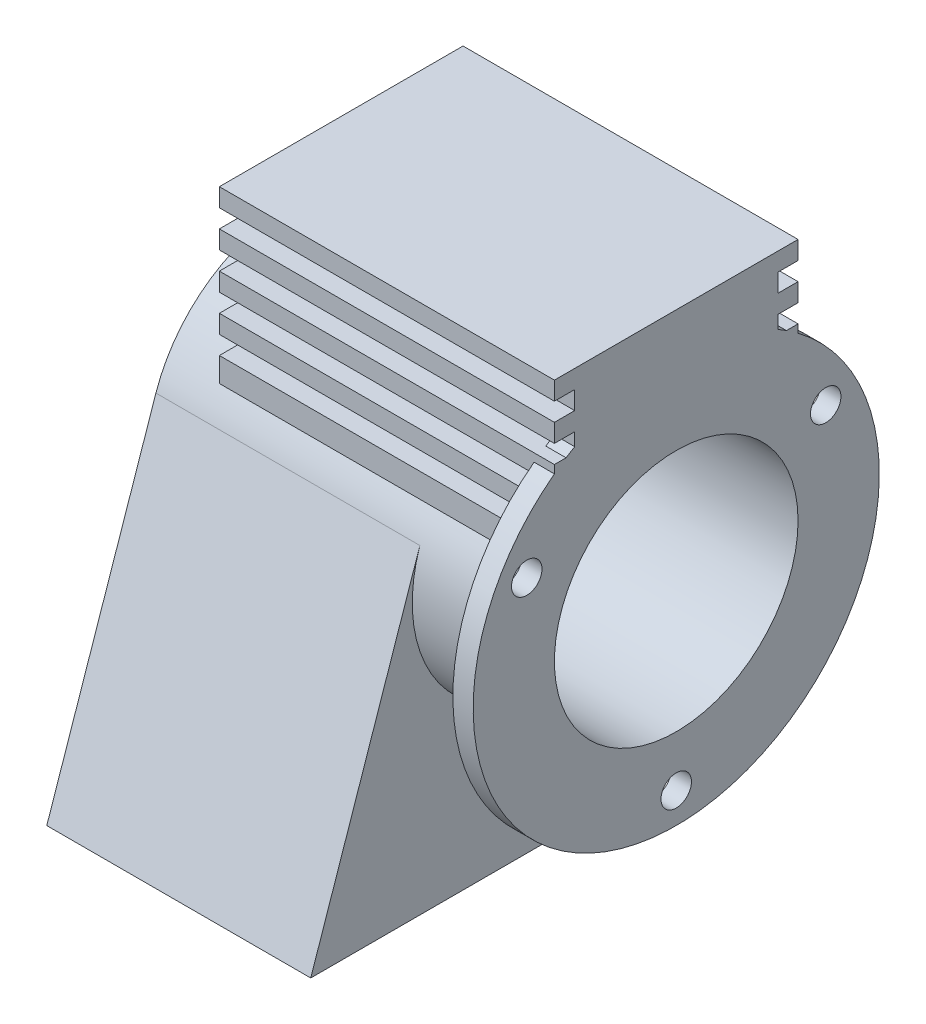
from build123d import *

# Parameters (mm, degrees)
BOSS_EXTRUDE1_DEPTH                                 = 165.1
SKETCH1_3_R                                         = 88.9
BOSS_EXTRUDE2_DEPTH                                 = 228.6
SKETCH2_R                                           = 127
BOSS_EXTRUDE3_DEPTH                                 = 12.7
BOSS_EXTRUDE4_START                                 = -209.55
BOSS_EXTRUDE4_DEPTH                                 = 209.55
CBORE_FOR_00_BINDING_HEAD_MACHINE_SCREW_D           = 38.1
CBORE_FOR_00_BINDING_HEAD_MACHINE_SCREW_CBORE_D     = 152.4
CBORE_FOR_00_BINDING_HEAD_MACHINE_SCREW_CBORE_DEPTH = 228.6
F_97_0_75_DIAMETER_HOLE1_D                          = 19.05
F_97_0_75_DIAMETER_HOLE1_DEPTH                      = 12.7
CIRPATTERN1_COUNT                                   = 3


with BuildPart() as part:
    # Sketch1 → Boss-Extrude1 (new body)
    with BuildSketch(Plane(origin=(0, 0, 0), x_dir=(0, 0, -1), z_dir=(1, 0, 0))):
        with BuildLine():
            Line((-84.14126771, 200.145941668), (-152.4, 0))
            Line((-152.4, 0), (152.4, 0))
            Line((152.4, 0), (84.14126771, 200.145941668))
            ThreePointArc((84.14126771, 200.145941668), (87.702248259, 185.993921421), (88.9, 171.45))
            ThreePointArc((88.9, 171.45), (-14.543921421, 83.747751741), (-84.14126771, 200.145941668))
        make_face()
    extrude(amount=BOSS_EXTRUDE1_DEPTH)

    # Sketch1<3> → Boss-Extrude2 (add)
    with BuildSketch(Plane(origin=(0, 0, 0), x_dir=(0, 0, -1), z_dir=(1, 0, 0))):
        with Locations(Location((0, 171.45, 0), (0, 0, 161.168324383))):
            Circle(SKETCH1_3_R)
    extrude(amount=BOSS_EXTRUDE2_DEPTH)

    # Sketch2 → Boss-Extrude3 (add)
    with BuildSketch(Plane(origin=(228.6, 0, 0), x_dir=(0, 0, -1), z_dir=(1, 0, 0))):
        with Locations((0, 171.45)):
            Circle(SKETCH2_R)
    extrude(amount=BOSS_EXTRUDE3_DEPTH)

    # Sketch3 → Boss-Extrude4 (add)
    with BuildSketch(Plane(origin=(241.3, 0, 0), x_dir=(0, 0, -1), z_dir=(1, 0, 0)).offset(BOSS_EXTRUDE4_START)):
        with BuildLine():
            Line((-76.2, 217.240501198), (-76.2, 232.41))
            Line((-76.2, 232.41), (-64.707715151, 232.41))
            ThreePointArc((-64.707715151, 232.41), (-70.860951664, 225.133661661), (-76.2, 217.240501198))
        make_face()
        with BuildLine():
            Line((-63.5, 233.667039467), (-63.5, 243.84))
            Line((-63.5, 243.84), (-76.2, 243.84))
            Line((-76.2, 243.84), (-76.2, 255.27))
            Line((-76.2, 255.27), (-63.5, 255.27))
            Line((-63.5, 255.27), (-63.5, 266.7))
            Line((-63.5, 266.7), (-76.2, 266.7))
            Line((-76.2, 266.7), (-76.2, 278.13))
            Line((-76.2, 278.13), (-63.5, 278.13))
            Line((-63.5, 278.13), (-63.5, 289.56))
            Line((-63.5, 289.56), (-76.2, 289.56))
            Line((-76.2, 289.56), (-76.2, 300.99))
            Line((-76.2, 300.99), (-63.5, 300.99))
            Line((-63.5, 300.99), (-63.5, 312.42))
            Line((-63.5, 312.42), (-76.2, 312.42))
            Line((-76.2, 312.42), (-76.2, 323.85))
            Line((-76.2, 323.85), (76.2, 323.85))
            Line((76.2, 323.85), (76.2, 312.42))
            Line((76.2, 312.42), (63.5, 312.42))
            Line((63.5, 312.42), (63.5, 300.99))
            Line((63.5, 300.99), (76.2, 300.99))
            Line((76.2, 300.99), (76.2, 289.56))
            Line((76.2, 289.56), (63.5, 289.56))
            Line((63.5, 289.56), (63.5, 278.13))
            Line((63.5, 278.13), (76.2, 278.13))
            Line((76.2, 278.13), (76.2, 266.7))
            Line((76.2, 266.7), (63.5, 266.7))
            Line((63.5, 266.7), (63.5, 255.27))
            Line((63.5, 255.27), (76.2, 255.27))
            Line((76.2, 255.27), (76.2, 243.84))
            Line((76.2, 243.84), (63.5, 243.84))
            Line((63.5, 243.84), (63.5, 233.667039467))
            ThreePointArc((63.5, 233.667039467), (0, 260.35), (-63.5, 233.667039467))
        make_face()
        with BuildLine():
            Line((76.2, 217.240501198), (76.2, 232.41))
            Line((76.2, 232.41), (64.707715151, 232.41))
            ThreePointArc((64.707715151, 232.41), (70.860951664, 225.133661661), (76.2, 217.240501198))
        make_face()
    extrude(amount=BOSS_EXTRUDE4_DEPTH)

    # CBORE for #00 Binding Head Machine Screw1 (through all)
    with Locations(Plane(origin=(241.3, 0, 0), x_dir=(0, 0, -1), z_dir=(1, 0, 0))):
        with Locations((0, 171.45)):
            CounterBoreHole(CBORE_FOR_00_BINDING_HEAD_MACHINE_SCREW_D / 2, CBORE_FOR_00_BINDING_HEAD_MACHINE_SCREW_CBORE_D / 2, CBORE_FOR_00_BINDING_HEAD_MACHINE_SCREW_CBORE_DEPTH)

    # #97 (0.75) Diameter Hole1
    with Locations(Plane(origin=(241.3, 0, 0), x_dir=(0, 0, -1), z_dir=(1, 0, 0))):
        with Locations((0, 63.5)):
            f_97_0_75_diameter_hole1 = Hole(F_97_0_75_DIAMETER_HOLE1_D / 2, depth=F_97_0_75_DIAMETER_HOLE1_DEPTH)

    # CirPattern1: #97 (0.75) Diameter Hole1 ×3 about axis
    cirpattern1_axis = Axis((0, 171.45, 0), (1, 0, 0))
    for i in range(1, CIRPATTERN1_COUNT):
        add(f_97_0_75_diameter_hole1.rotate(cirpattern1_axis, i * 360 / CIRPATTERN1_COUNT), mode=Mode.SUBTRACT)


solid = part.part
